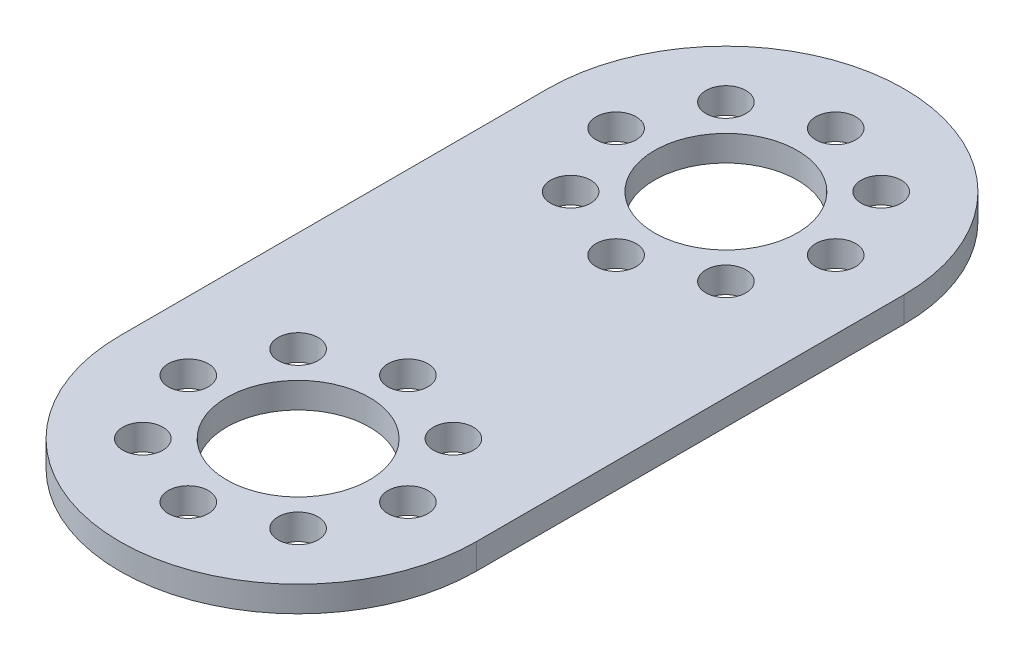
from build123d import *

# Parameters (mm, degrees)
SKETCH1_R           = 6.3627
SKETCH1_R_2         = 1.78435
BOSS_EXTRUDE1_DEPTH = 2.286


with BuildPart() as part:
    # Sketch1 → Boss-Extrude1 (new body)
    with BuildSketch(Plane.XZ):
        with BuildLine():
            Line((15.875, -19.05), (15.875, 19.05))
            ThreePointArc((15.875, 19.05), (0, 34.925), (-15.875, 19.05))
            Line((-15.875, 19.05), (-15.875, -19.05))
            ThreePointArc((-15.875, -19.05), (0, -34.925), (15.875, -19.05))
        make_face()
        with Locations(Location((0, -19.05, 0), (0, 0, 90))):
            Circle(SKETCH1_R, mode=Mode.SUBTRACT)
        with Locations(Location((0, 19.05, 0), (0, 0, 90))):
            Circle(SKETCH1_R, mode=Mode.SUBTRACT)
        with Locations(Location((9.779, 19.05, 0), (0, 0, 90))):
            Circle(SKETCH1_R_2, mode=Mode.SUBTRACT)
        with Locations(Location((6.914797213, 12.135202787, 0), (0, 0, 90))):
            Circle(SKETCH1_R_2, mode=Mode.SUBTRACT)
        with Locations(Location((0, 9.271, 0), (0, 0, 90))):
            Circle(SKETCH1_R_2, mode=Mode.SUBTRACT)
        with Locations(Location((-6.914797213, 12.135202787, 0), (0, 0, 90))):
            Circle(SKETCH1_R_2, mode=Mode.SUBTRACT)
        with Locations(Location((-9.779, 19.05, 0), (0, 0, 90))):
            Circle(SKETCH1_R_2, mode=Mode.SUBTRACT)
        with Locations(Location((-6.914797213, 25.964797213, 0), (0, 0, 90))):
            Circle(SKETCH1_R_2, mode=Mode.SUBTRACT)
        with Locations(Location((0, 28.829, 0), (0, 0, 90))):
            Circle(SKETCH1_R_2, mode=Mode.SUBTRACT)
        with Locations(Location((6.914797213, 25.964797213, 0), (0, 0, 90))):
            Circle(SKETCH1_R_2, mode=Mode.SUBTRACT)
        with Locations(Location((9.779, -19.05, 0), (0, 0, 90))):
            Circle(SKETCH1_R_2, mode=Mode.SUBTRACT)
        with Locations(Location((6.914797213, -12.135202787, 0), (0, 0, 90))):
            Circle(SKETCH1_R_2, mode=Mode.SUBTRACT)
        with Locations(Location((0, -9.271, 0), (0, 0, 90))):
            Circle(SKETCH1_R_2, mode=Mode.SUBTRACT)
        with Locations(Location((-6.914797213, -12.135202787, 0), (0, 0, 90))):
            Circle(SKETCH1_R_2, mode=Mode.SUBTRACT)
        with Locations(Location((-9.779, -19.05, 0), (0, 0, 90))):
            Circle(SKETCH1_R_2, mode=Mode.SUBTRACT)
        with Locations(Location((-6.914797213, -25.964797213, 0), (0, 0, 90))):
            Circle(SKETCH1_R_2, mode=Mode.SUBTRACT)
        with Locations(Location((0, -28.829, 0), (0, 0, 90))):
            Circle(SKETCH1_R_2, mode=Mode.SUBTRACT)
        with Locations(Location((6.914797213, -25.964797213, 0), (0, 0, 90))):
            Circle(SKETCH1_R_2, mode=Mode.SUBTRACT)
    extrude(amount=-BOSS_EXTRUDE1_DEPTH)


solid = part.part
